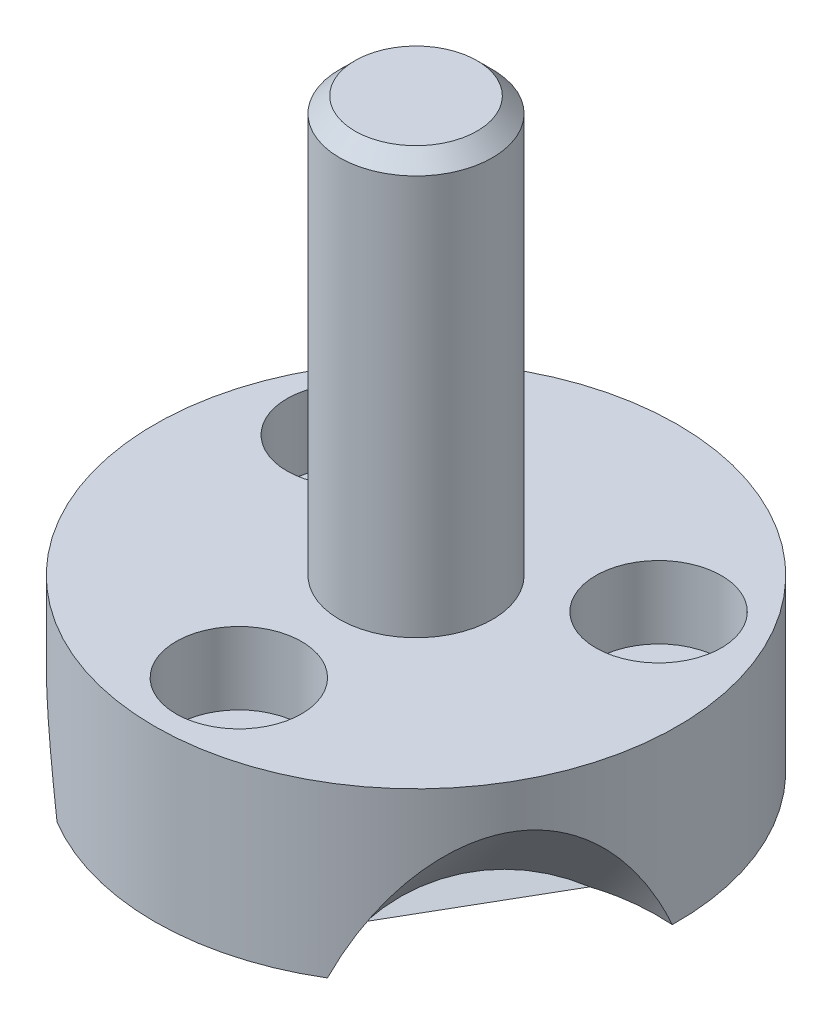
from build123d import *

# Parameters (mm, degrees)
SKETCH1_R           = 8.5
BOSS_EXTRUDE1_DEPTH = 5.5
SKETCH10_R          = 2.485
BOSS_EXTRUDE3_DEPTH = 13.5
SKETCH12_R          = 4.5
CUT_EXTRUDE4_DEPTH  = 2.54
CHAMFER2_SIZE       = 0.5
SKETCH14_R          = 2.04
CUT_EXTRUDE5_DEPTH  = 2.35
SKETCH15_R          = 1.065
CUT_EXTRUDE6_DEPTH  = 19.076227483
SKETCH16_R          = 5
CUT_EXTRUDE7_DEPTH  = 10
CIRPATTERN1_COUNT   = 3


with BuildPart() as part:
    # Sketch1 → Boss-Extrude1 (new body)
    with BuildSketch(Plane(origin=(0, 0, 0), x_dir=(1, 0, 0), z_dir=(0, 1, 0))):
        with Locations(Location((0, 0, 0), (0, 0, 270))):
            Circle(SKETCH1_R)
    extrude(amount=-BOSS_EXTRUDE1_DEPTH)

    # Sketch10 → Boss-Extrude3 (add)
    with BuildSketch(Plane(origin=(0, 0, 0), x_dir=(1, 0, 0), z_dir=(0, 1, 0))):
        with Locations(Location((0, 0, 0), (0, 0, 270))):
            Circle(SKETCH10_R)
    extrude(amount=BOSS_EXTRUDE3_DEPTH)

    # Sketch12 → Cut-Extrude4 (cut)
    with BuildSketch(Plane.XZ.offset(5.5)):
        with Locations(Location((0, 0, 0), (0, 0, 270))):
            Circle(SKETCH12_R)
    extrude(amount=-CUT_EXTRUDE4_DEPTH, mode=Mode.SUBTRACT)

    # Chamfer2
    chamfer2_edges = [part.edges().sort_by_distance(p)[0] for p in [
        (0, 13.5, -2.485),
    ]]
    chamfer(chamfer2_edges, length=CHAMFER2_SIZE)

    # Sketch14 → Cut-Extrude5 (cut)
    with BuildSketch(Plane(origin=(0, 0, 0), x_dir=(1, 0, 0), z_dir=(0, 1, 0))):
        with Locations(Location((0, -5.7605, 0), (0, 0, 270))):
            Circle(SKETCH14_R)
        with Locations(Location((-5.033935185, 2.880072698, 0), (0, 0, 270))):
            Circle(SKETCH14_R)
        with Locations(Location((4.965987867, 2.919302101, 0), (0, 0, 270))):
            Circle(SKETCH14_R)
    extrude(amount=-CUT_EXTRUDE5_DEPTH, mode=Mode.SUBTRACT)

    # Sketch15 → Cut-Extrude6 (cut, through all)
    with BuildSketch(Plane(origin=(0, 0, 0), x_dir=(1, 0, 0), z_dir=(0, 1, 0))):
        with Locations(Location((4.965987867, 2.919302101, 0), (0, 0, 270))):
            Circle(SKETCH15_R)
        with Locations(Location((-5.033935185, 2.880072698, 0), (0, 0, 270))):
            Circle(SKETCH15_R)
        with Locations(Location((0, -5.7605, 0), (0, 0, 270))):
            Circle(SKETCH15_R)
    extrude(amount=-CUT_EXTRUDE6_DEPTH, mode=Mode.SUBTRACT)

    # Sketch16 → Cut-Extrude7 (cut)
    with BuildSketch(Plane(origin=(0, 0, 0), x_dir=(-1, 0, 0), z_dir=(0, 0.7071067811865475, -0.7071067811865477))):
        with Locations((0, -12.01040764)):
            Circle(SKETCH16_R)
    cut_extrude7 = extrude(amount=CUT_EXTRUDE7_DEPTH, mode=Mode.SUBTRACT)

    # CirPattern1: Cut-Extrude7 ×3 about axis
    cirpattern1_axis = Axis((0, 0, 0), (0, 1, 0))
    for i in range(1, CIRPATTERN1_COUNT):
        add(cut_extrude7.rotate(cirpattern1_axis, i * 360 / CIRPATTERN1_COUNT), mode=Mode.SUBTRACT)


solid = part.part
